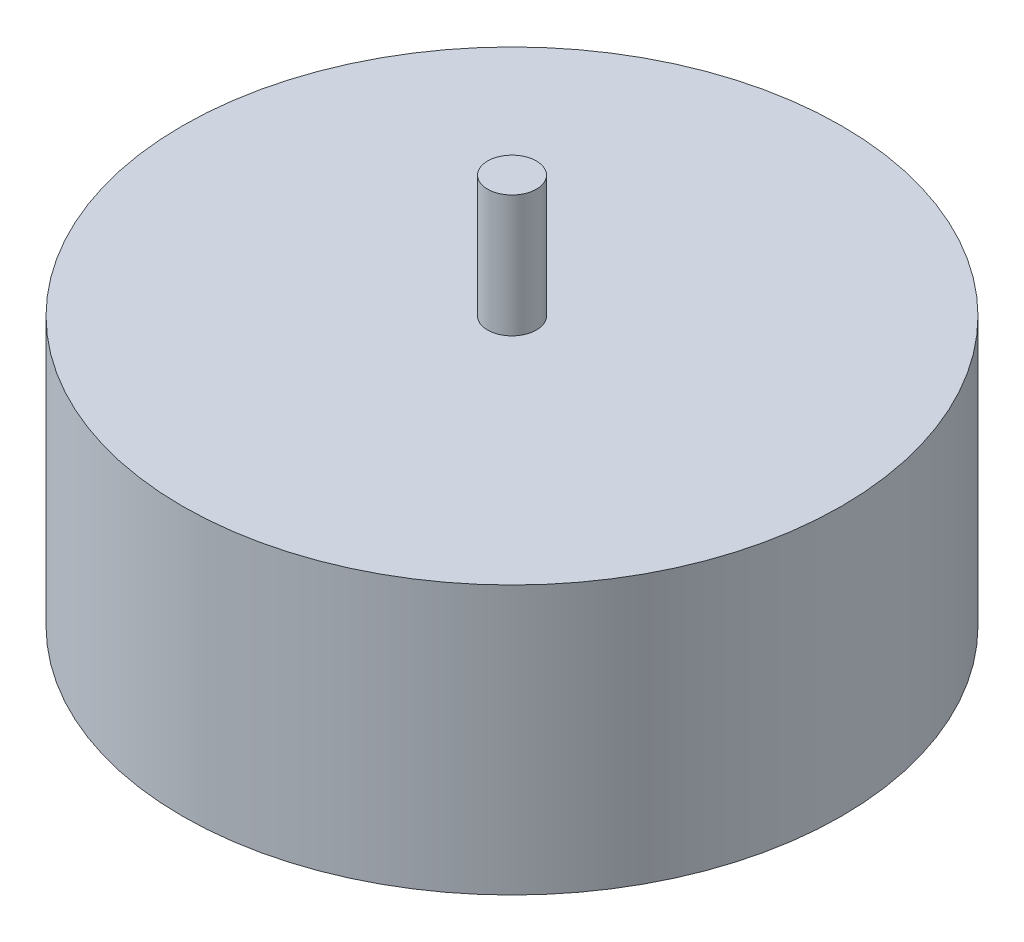
from build123d import *

# Parameters (mm, degrees)
SKETCH1_R                = 27
BOSS_EXTRUDE1_DEPTH      = 22
BOSS_EXTRUDE2_DEPTH      = 10
BOSS_EXTRUDE2_DEPTH_BACK = 30.48
SKETCH2_R                = 2


with BuildPart() as part:
    # Sketch1 → Boss-Extrude1 (new body)
    with BuildSketch(Plane(origin=(0, 0, 0), x_dir=(1, 0, 0), z_dir=(0, 1, 0))):
        with Locations(Location((0, 0, 0), (0, 0, 270))):
            Circle(SKETCH1_R)
    extrude(amount=BOSS_EXTRUDE1_DEPTH)

    # Sketch2 → Boss-Extrude2 (add, two sides: drawn at the far end of the back side and taken through both)
    with BuildSketch(Plane(origin=(0, 22, 0), x_dir=(1, 0, 0), z_dir=(0, 1, 0)).offset(-BOSS_EXTRUDE2_DEPTH_BACK)):
        with Locations(Location((0, 0, 0), (0, 0, 270))):
            Circle(SKETCH2_R)
    extrude(amount=BOSS_EXTRUDE2_DEPTH + BOSS_EXTRUDE2_DEPTH_BACK)


solid = part.part
